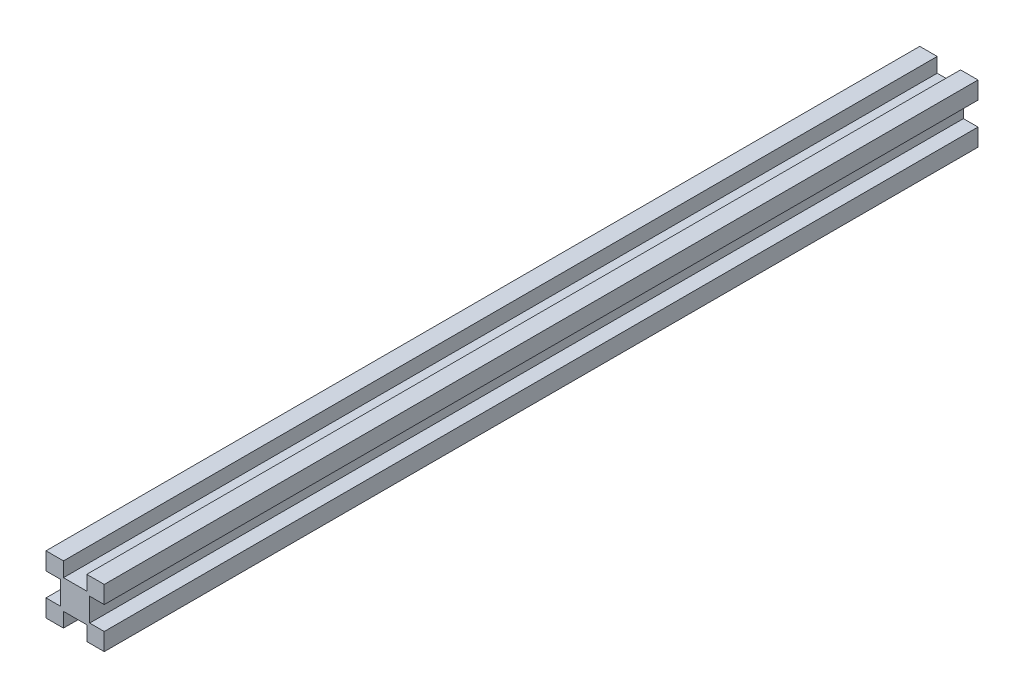
from build123d import *

# Parameters (mm, degrees)
CROQUIS1_W              = 20
CROQUIS1_H              = 20
SALIENTE_EXTRUIR1_DEPTH = 300
CORTAR_EXTRUIR1_DEPTH   = 320


with BuildPart() as part:
    # Croquis1 → Saliente-Extruir1 (new body)
    with BuildSketch(Plane.XY):
        with Locations((-13.532555049, 4.541666667)):
            Rectangle(CROQUIS1_W, CROQUIS1_H)
    extrude(amount=SALIENTE_EXTRUIR1_DEPTH)

    # Croquis2 → Cortar-Extruir1 (cut)
    with BuildSketch(Plane.XY.offset(300)):
        Polygon((-13.532555049, 9.541666667), (-17.532555049, 9.541666667), (-17.532555049, 14.541666667), (-9.532555049, 14.541666667), (-9.532555049, 9.541666667), align=None)
        Polygon((-9.532555049, -0.458333333), (-9.532555049, -5.458333333), (-17.532555049, -5.458333333), (-17.532555049, -0.458333333), (-13.532555049, -0.458333333), align=None)
        Polygon((-23.532555049, 4.541666667), (-23.532555049, 8.541666667), (-18.532555049, 8.541666667), (-18.532555049, 0.541666667), (-23.532555049, 0.541666667), align=None)
        Polygon((-8.532555049, 8.541666667), (-8.532555049, 0.541666667), (-3.532555049, 0.541666667), (-3.532555049, 4.541666667), (-3.532555049, 8.541666667), align=None)
    extrude(amount=-CORTAR_EXTRUIR1_DEPTH, mode=Mode.SUBTRACT)


solid = part.part
